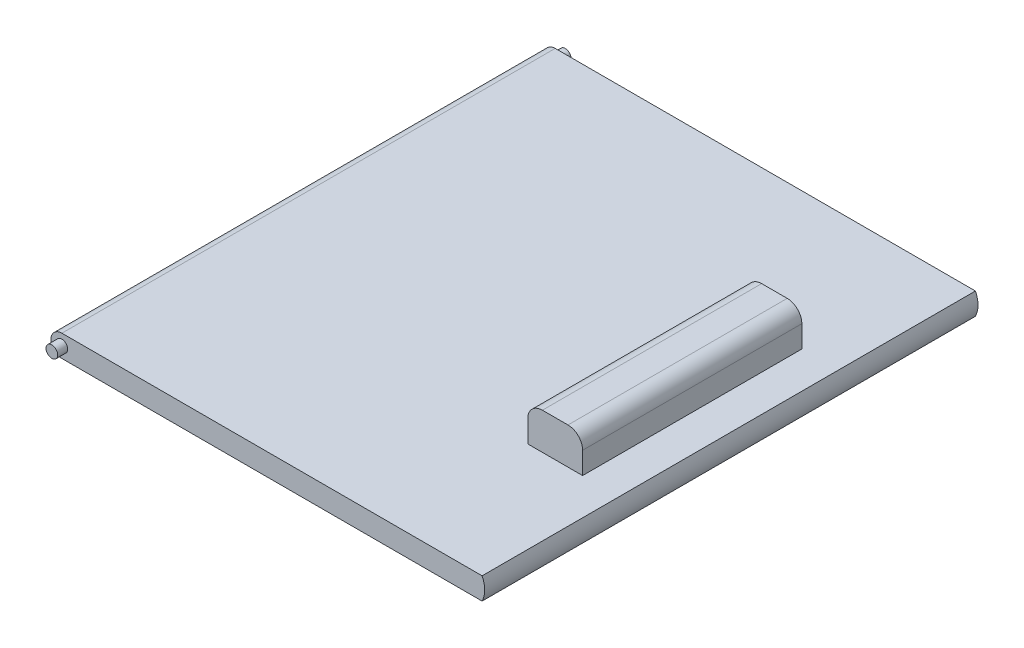
from build123d import *

# Parameters (mm, degrees)
BOSS_EXTRUDE1_DEPTH = 67.5
SKETCH2_R           = 0.8
BOSS_EXTRUDE2_DEPTH = 1.375
BOSS_EXTRUDE3_START = 1.375
SKETCH3_R           = 0.8
BOSS_EXTRUDE3_DEPTH = 1.375
BOSS_EXTRUDE4_DEPTH = 67.5
SKETCH5_W           = 7.5
SKETCH5_H           = 30
BOSS_EXTRUDE5_DEPTH = 5
FILLET1_R           = 2


with BuildPart() as part:
    # Sketch1 → Boss-Extrude1 (new body)
    with BuildSketch(Plane.XY):
        with BuildLine():
            Line((0, -1.5), (57.5, -1.5))
            Line((57.5, -1.5), (57.5, 1.5))
            Line((57.5, 1.5), (0, 1.5))
            ThreePointArc((0, 1.5), (-1.5, 0), (0, -1.5))
        make_face()
    extrude(amount=BOSS_EXTRUDE1_DEPTH)

    # Sketch2 → Boss-Extrude2 (add)
    with BuildSketch(Plane.XY.offset(67.5)):
        Circle(SKETCH2_R)
    extrude(amount=BOSS_EXTRUDE2_DEPTH)

    # Sketch3 → Boss-Extrude3 (add)
    with BuildSketch(Plane(origin=(0, 0, 0), x_dir=(-1, 0, 0), z_dir=(0, 0, -1)).offset(BOSS_EXTRUDE3_START)):
        with Locations(Location((0, 0, 0), (0, 0, 180))):
            Circle(SKETCH3_R)
    extrude(amount=-BOSS_EXTRUDE3_DEPTH)

    # Sketch4 → Boss-Extrude4 (add)
    with BuildSketch(Plane.XY.offset(67.5)):
        with BuildLine():
            Line((57.5, 1.5), (57.5, -1.5))
            ThreePointArc((57.5, -1.5), (57.854101966, 0), (57.5, 1.5))
        make_face()
    extrude(amount=-BOSS_EXTRUDE4_DEPTH)

    # Sketch5 → Boss-Extrude5 (add)
    with BuildSketch(Plane(origin=(0, 1.5, 0), x_dir=(1, 0, 0), z_dir=(0, 1, 0))):
        with Locations((48.75, -33.75)):
            Rectangle(SKETCH5_W, SKETCH5_H)
    extrude(amount=BOSS_EXTRUDE5_DEPTH)

    # Fillet1
    fillet1_edges = [part.edges().sort_by_distance(p)[0] for p in [
        (45, 6.5, 33.75),
        (52.5, 6.5, 33.75),
    ]]
    fillet(fillet1_edges, radius=FILLET1_R)


solid = part.part
